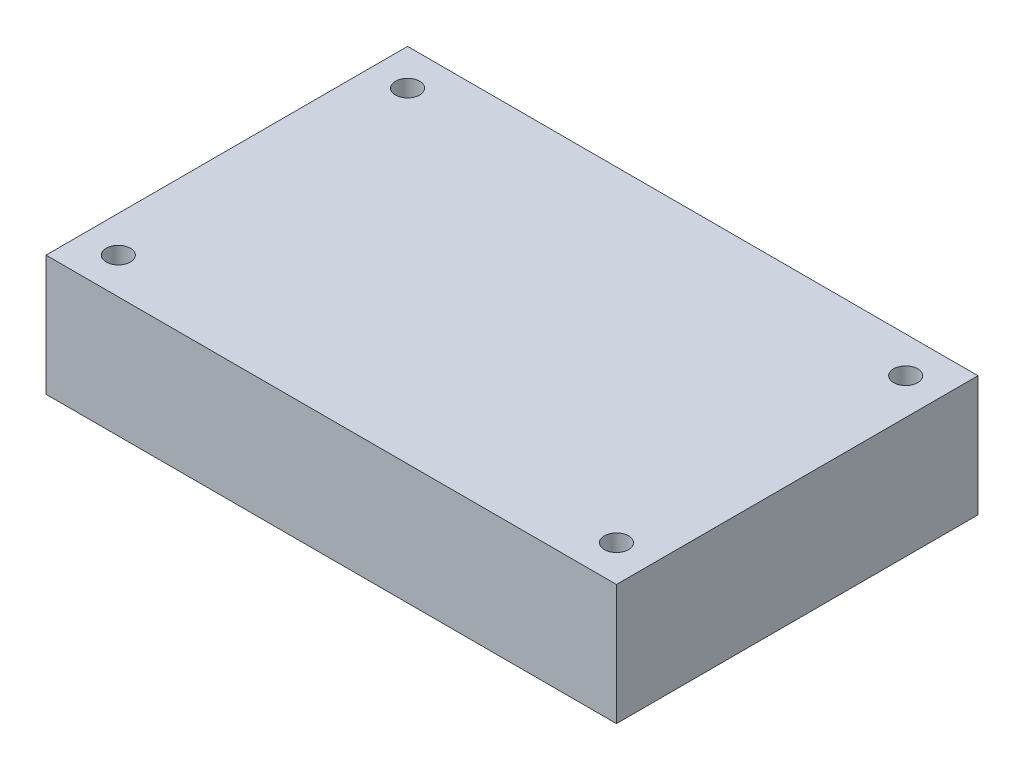
from build123d import *

# Parameters (mm, degrees)
SKETCH_1_W      = 71
SKETCH_1_H      = 45
SKETCH_1_R      = 1.5
EXTRUDE_1_DEPTH = 15


with BuildPart() as part:
    # 草图1 → 凸台-拉伸1 (new body)
    with BuildSketch(Plane(origin=(0, 0, 0), x_dir=(1, 0, 0), z_dir=(0, 1, 0))):
        with Locations((35.5, 22.5)):
            Rectangle(SKETCH_1_W, SKETCH_1_H)
        with Locations(Location((4.5, 4.5, 0), (0, 0, 270))):
            Circle(SKETCH_1_R, mode=Mode.SUBTRACT)
        with Locations(Location((4.5, 40.5, 0), (0, 0, 270))):
            Circle(SKETCH_1_R, mode=Mode.SUBTRACT)
        with Locations(Location((66.5, 40.5, 0), (0, 0, 270))):
            Circle(SKETCH_1_R, mode=Mode.SUBTRACT)
        with Locations(Location((66.5, 4.5, 0), (0, 0, 270))):
            Circle(SKETCH_1_R, mode=Mode.SUBTRACT)
    extrude(amount=EXTRUDE_1_DEPTH)


solid = part.part
